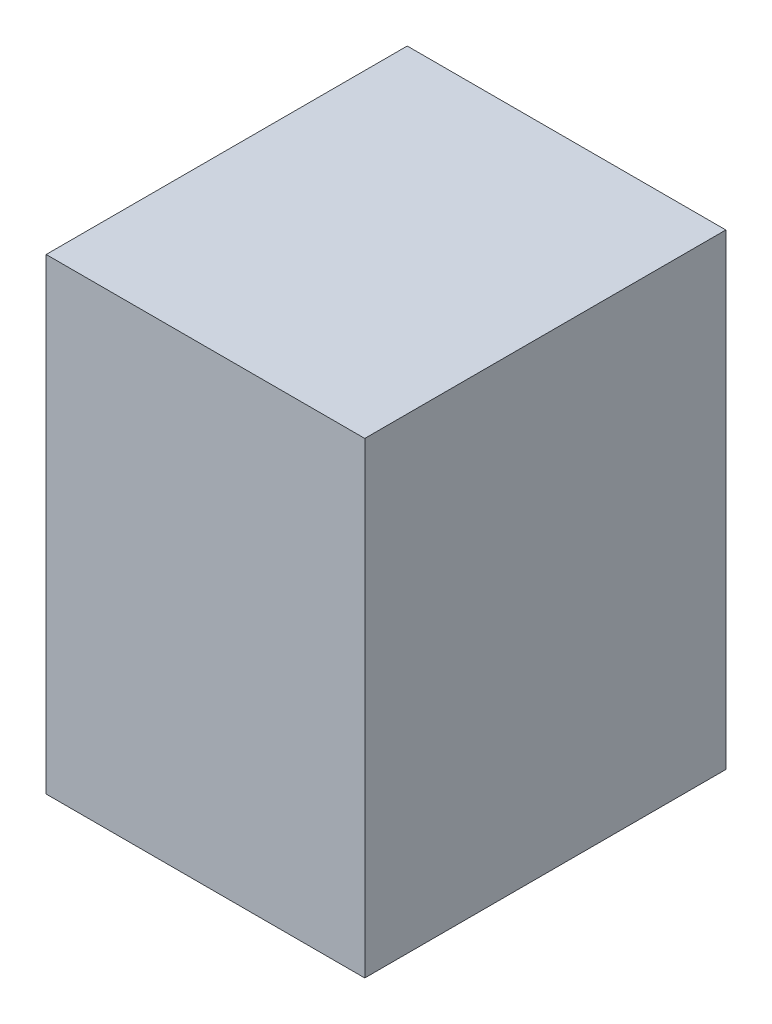
from build123d import *

# Parameters (mm, degrees)
SKETCH1_W           = 43.18
SKETCH1_H           = 55.88
BOSS_EXTRUDE1_DEPTH = 38.1


with BuildPart() as part:
    # Sketch1 → Boss-Extrude1 (new body)
    with BuildSketch(Plane(origin=(0, 0, 0), x_dir=(0, 0, -1), z_dir=(1, 0, 0))):
        with Locations((6.948060942, 27.94)):
            Rectangle(SKETCH1_W, SKETCH1_H)
    extrude(amount=BOSS_EXTRUDE1_DEPTH)


solid = part.part
